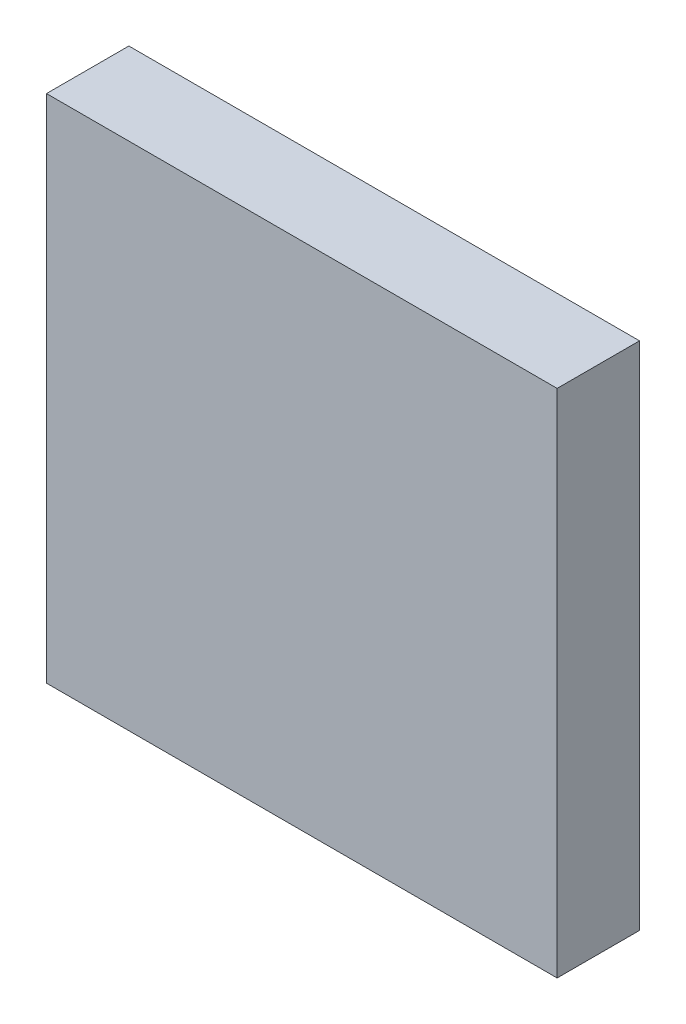
from build123d import *

# Parameters (mm, degrees)
SKETCH_5_W      = 62
SKETCH_5_H      = 62
EXTRUDE_2_DEPTH = 10


with BuildPart() as part:
    # Эскиз5 → Бобышка-Вытянуть2 (new body)
    with BuildSketch(Plane.XY):
        Rectangle(SKETCH_5_W, SKETCH_5_H)
    extrude(amount=EXTRUDE_2_DEPTH)


solid = part.part
